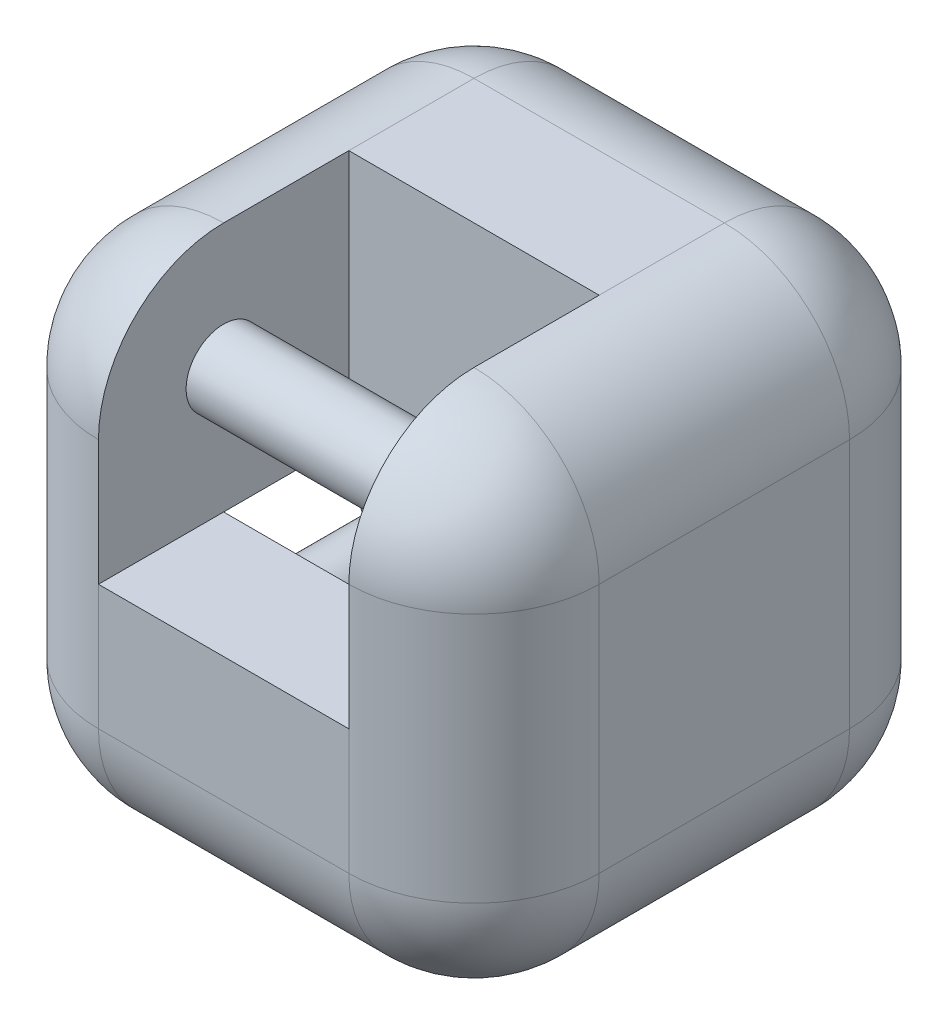
from build123d import *

# Parameters (mm, degrees)
SKETCH_1_W          = 20
SKETCH_1_H          = 20
EXTRUDE_1_DEPTH     = 20
FILLET_1_R          = 5
SKETCH_2_W          = 10
SKETCH_2_H          = 10
CUT_EXTRUDE_1_DEPTH = 10
SKETCH_3_W          = 10
SKETCH_3_H          = 10
CUT_EXTRUDE_2_DEPTH = 10
SKETCH_4_R          = 1.5
EXTRUDE_2_DEPTH     = 10
SKETCH_5_R          = 1.5
EXTRUDE_3_DEPTH     = 10


with BuildPart() as part:
    # 草图1 → 凸台-拉伸1 (new body)
    with BuildSketch(Plane.XY):
        with Locations((-13.408142688, 27.165559881)):
            Rectangle(SKETCH_1_W, SKETCH_1_H)
    extrude(amount=EXTRUDE_1_DEPTH)

    # 圆角1
    fillet_1_edges = [part.edges().sort_by_distance(p)[0] for p in [
        (-3.408142688, 27.165559881, 20),
        (-13.408142688, 37.165559881, 20),
        (-23.408142688, 27.165559881, 20),
        (-13.408142688, 37.165559881, 0),
        (-3.408142688, 27.165559881, 0),
        (-13.408142688, 17.165559881, 0),
        (-23.408142688, 27.165559881, 0),
        (-13.408142688, 17.165559881, 20),
        (-23.408142688, 37.165559881, 10),
        (-3.408142688, 37.165559881, 10),
        (-3.408142688, 17.165559881, 10),
        (-23.408142688, 17.165559881, 10),
    ]]
    fillet(fillet_1_edges, radius=FILLET_1_R)

    # 草图2 → 切除-拉伸1 (cut)
    with BuildSketch(Plane.ZY.offset(8.408142688)):
        with Locations((15, 32.165559881)):
            Rectangle(SKETCH_2_W, SKETCH_2_H)
    extrude(amount=CUT_EXTRUDE_1_DEPTH, mode=Mode.SUBTRACT)

    # 草图3 → 切除-拉伸2 (cut)
    with BuildSketch(Plane(origin=(0, 0, 15), x_dir=(-1, 0, 0), z_dir=(0, 0, -1))):
        with Locations((18.408142688, 22.165559881)):
            Rectangle(SKETCH_3_W, SKETCH_3_H)
    extrude(amount=CUT_EXTRUDE_2_DEPTH, mode=Mode.SUBTRACT)


with BuildPart() as body_2:
    # 草图4 → 凸台-拉伸2 (new body)
    with BuildSketch(Plane.ZY.offset(8.408142688)):
        with Locations((15, 32.165559881)):
            Circle(SKETCH_4_R)
    extrude(amount=EXTRUDE_2_DEPTH)


with BuildPart() as body_3:
    # 草图5 → 凸台-拉伸3 (new body)
    with BuildSketch(Plane(origin=(0, 0, 15), x_dir=(-1, 0, 0), z_dir=(0, 0, -1))):
        with Locations((18.408142688, 22.165559881)):
            Circle(SKETCH_5_R)
    extrude(amount=EXTRUDE_3_DEPTH)


solid = Compound([part.part, body_2.part, body_3.part])
